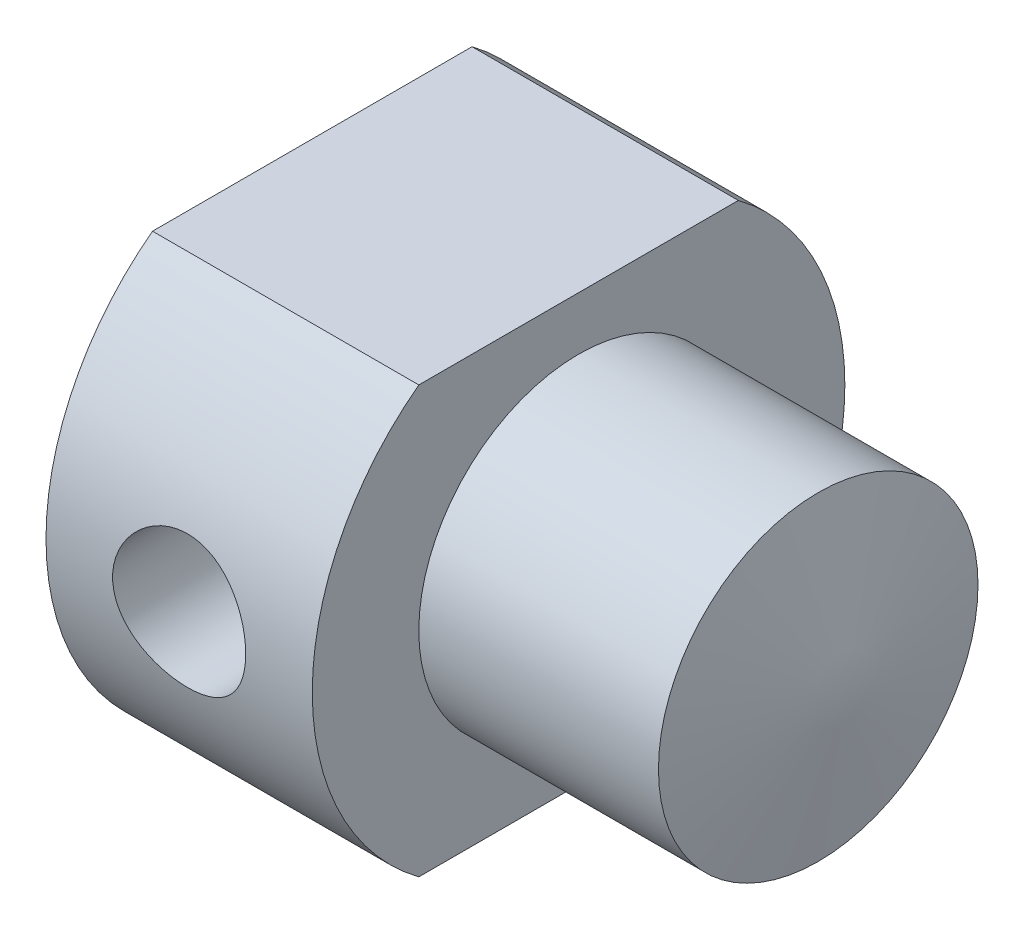
from build123d import *

# Parameters (mm, degrees)
SKETCH_2_R          = 2.5
SKETCH_2_W          = 13.733275584
SKETCH_2_H          = 7.68132945
CUT_EXTRUDE_1_DEPTH = 15


with BuildPart() as part:
    # Эскиз1 → Повернуть1 (revolve)
    with BuildSketch(Plane.XY, mode=Mode.PRIVATE) as revolve_1_sk:
        Polygon((0, 0), (-1.057961884, 6), (-10.057961884, 6), (-10.057961884, 10), (-20.057961884, 10), (-20.057961884, 0), align=None)
    revolve(revolve_1_sk.sketch.rotate(Axis((0, 0, 0), (-1, 0, 0)), 90), axis=Axis((0, 0, 0), (-1, 0, 0)))

    # Эскиз2 → Вырез-Вытянуть1 (cut, symmetric)
    with BuildSketch(Plane.XY):
        with Locations((-15.057961884, 0)):
            Circle(SKETCH_2_R)
        with Locations((-14.936439869, -11.840664725)):
            Rectangle(SKETCH_2_W, SKETCH_2_H)
        with Locations((-14.936439869, 11.840664725)):
            Rectangle(SKETCH_2_W, SKETCH_2_H)
    extrude(amount=CUT_EXTRUDE_1_DEPTH, both=True, mode=Mode.SUBTRACT)


solid = part.part
